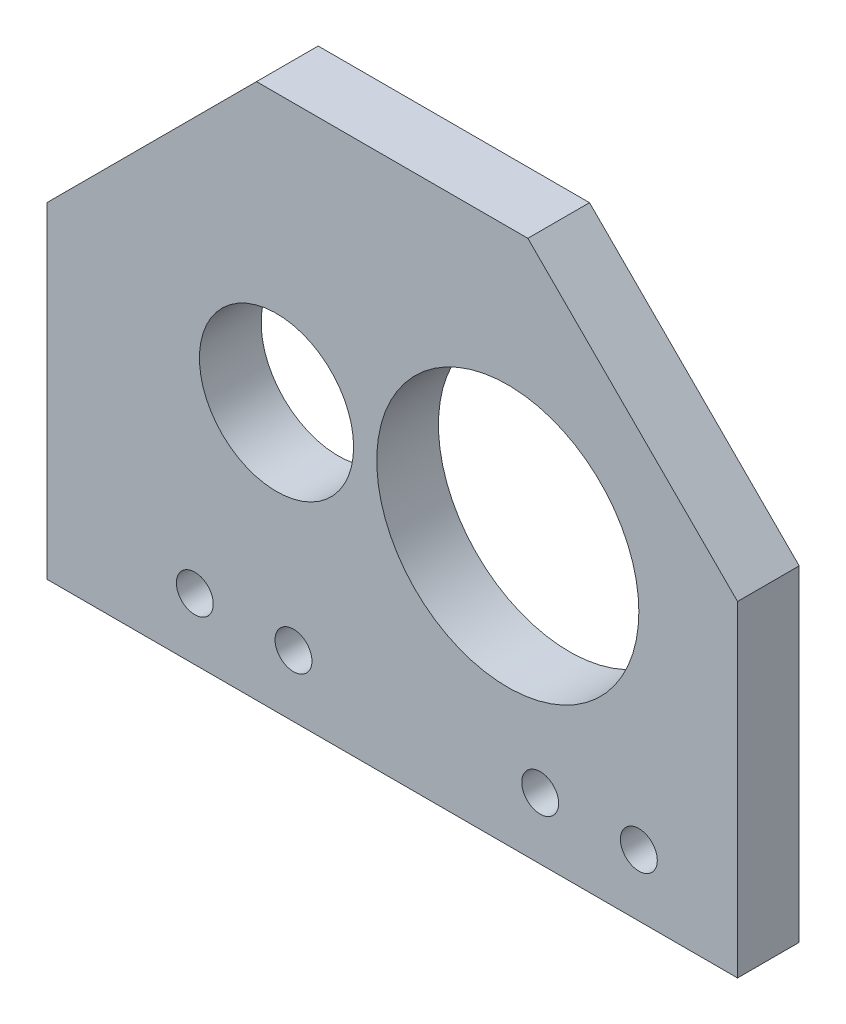
from build123d import *

# Parameters (mm, degrees)
SKETCH1_W             = 71.12
SKETCH1_H             = 55.16372
SKETCH1_R             = 13.49375
SKETCH1_R_2           = 7.9375
BOSS_EXTRUDE1_DEPTH   = 6.35
F_6_CLEARANCE_HOLE1_D = 3.7973
CUT_EXTRUDE1_DEPTH    = 46.448818478


with BuildPart() as part:
    # Sketch1 → Boss-Extrude1 (new body)
    with BuildSketch(Plane.XY):
        Rectangle(SKETCH1_W, SKETCH1_H)
        with Locations((11.90625, 0)):
            Circle(SKETCH1_R, mode=Mode.SUBTRACT)
        with Locations((-11.90625, 0)):
            Circle(SKETCH1_R_2, mode=Mode.SUBTRACT)
    extrude(amount=BOSS_EXTRUDE1_DEPTH)

    # #6 Clearance Hole1 (through all)
    with Locations(Plane.XY.offset(6.35)):
        with Locations((-20.32, -21.23186), (-10.16, -21.23186), (15.24, -21.23186), (25.4, -21.23186)):
            Hole(F_6_CLEARANCE_HOLE1_D / 2)

    # Sketch4 → Cut-Extrude1 (cut, through all)
    with BuildSketch(Plane.XY.offset(6.35)):
        Polygon((-35.56, 5.99186), (-13.97, 27.58186), (-35.56, 27.58186), align=None)
        Polygon((35.56, 5.99186), (13.97, 27.58186), (35.56, 27.58186), align=None)
    extrude(amount=-CUT_EXTRUDE1_DEPTH, mode=Mode.SUBTRACT)


solid = part.part
